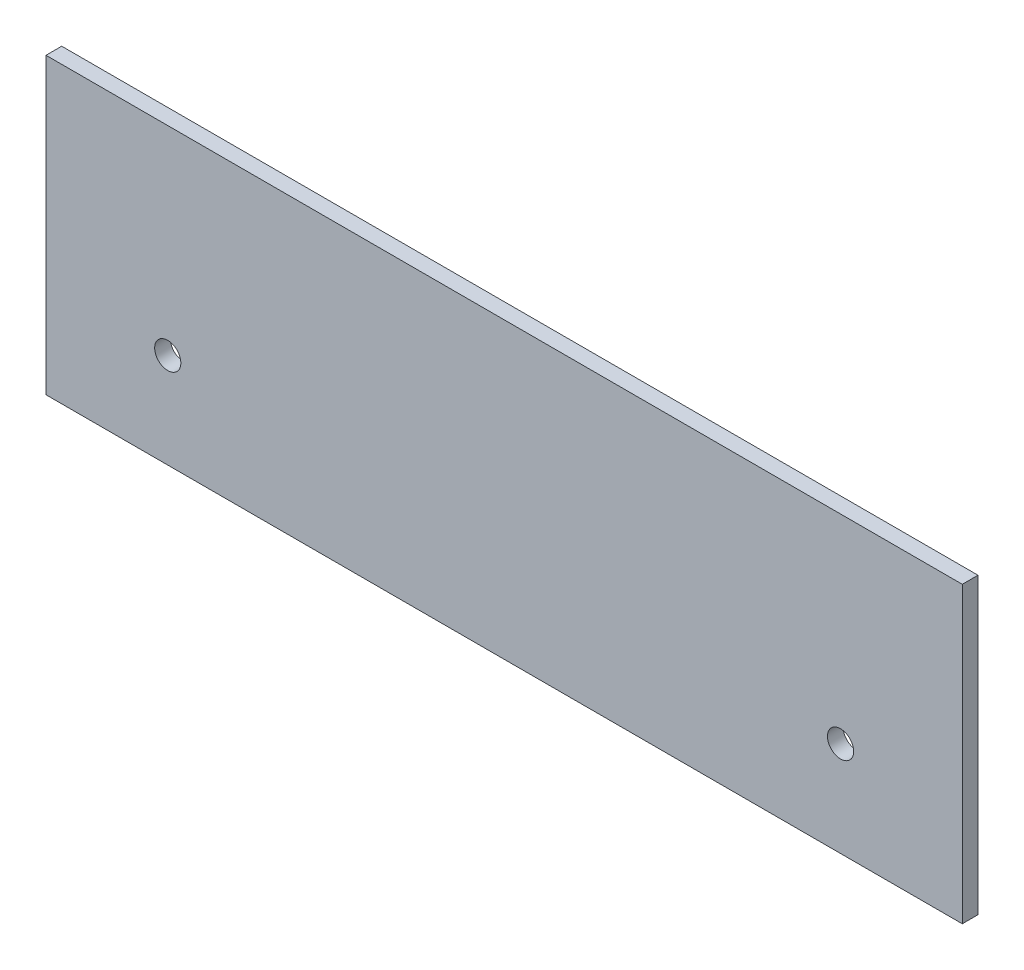
from build123d import *

# Parameters (mm, degrees)
ESQUISSE2_W             = 175
ESQUISSE2_H             = 3
BOSS_EXTRU_1_DEPTH      = 36.27
ESQUISSE3_R             = 2.5
ENL_V_MAT_EXTRU_1_DEPTH = 106.213182302
SKETCH1_W               = 175
SKETCH1_H               = 19.88750008
BOSS_EXTRUDE1_DEPTH     = 3


with BuildPart() as part:
    # Esquisse2 → Boss.-Extru.1 (new body)
    with BuildSketch(Plane(origin=(0, 0, 0), x_dir=(1, 0, 0), z_dir=(0, 1, 0))):
        with Locations((11.218290251, -2.666038947)):
            Rectangle(ESQUISSE2_W, ESQUISSE2_H)
    extrude(amount=BOSS_EXTRU_1_DEPTH)

    # Esquisse3 → Enlèv. mat.-Extru.1 (cut, through all)
    with BuildSketch(Plane.XY.offset(4.166038947)):
        with Locations((-53.031709749, 18.135)):
            Circle(ESQUISSE3_R)
        with Locations((75.468290251, 18.135)):
            Circle(ESQUISSE3_R)
    extrude(amount=-ENL_V_MAT_EXTRU_1_DEPTH, mode=Mode.SUBTRACT)

    # Sketch1 → Boss-Extrude1 (add)
    with BuildSketch(Plane.XY.offset(4.166038947)):
        with Locations((11.218290251, 46.21375004)):
            Rectangle(SKETCH1_W, SKETCH1_H)
    extrude(amount=-BOSS_EXTRUDE1_DEPTH)


solid = part.part
